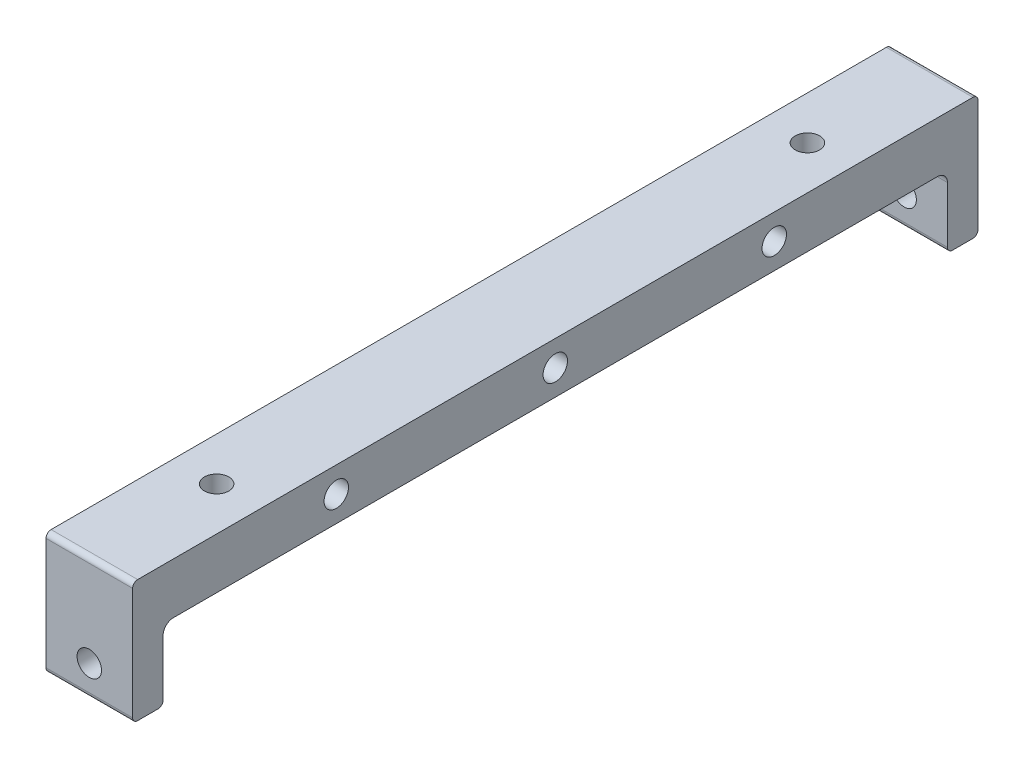
from build123d import *

# Parameters (mm, degrees)
SKETCH1_W           = 8.5
SKETCH1_H           = 12
BOSS_EXTRUDE1_DEPTH = 41.5
CUT_EXTRUDE1_DEPTH  = 43.784342931
FILLET1_R           = 0.5
M2_HOLE1_R_D        = 2.4
M2_HOLE1_R_DEPTH    = 5
M2_HOLE1_R_TIP      = 0.721032743
M2_HOLE2_T_D        = 2.4
M2_HOLE2_T_DEPTH    = 4
M2_HOLE2_T_TIP      = 0.721032743
M2_HOLE3_U_D        = 2.4
M2_HOLE3_U_DEPTH    = 10
M2_HOLE3_U_TIP      = 0.721032743
M2_HOLE4_V_D        = 2.4
M2_HOLE5_W_D        = 2.4
M2_HOLE5_W_DEPTH    = 5
M2_HOLE5_W_TIP      = 0.721032743
M2_HOLE6_Y_D        = 2.4
M2_HOLE6_Y_DEPTH    = 10
M2_HOLE6_Y_TIP      = 0.721032743


with BuildPart() as part:
    # Sketch1 → Boss-Extrude1 (new, symmetric)
    with BuildSketch(Plane.XY):
        Rectangle(SKETCH1_W, SKETCH1_H)
    extrude(amount=BOSS_EXTRUDE1_DEPTH, both=True)

    # Sketch2 → Cut-Extrude1 (cut, through all)
    with BuildSketch(Plane(origin=(4.25, 0, 0), x_dir=(0, 0, -1), z_dir=(1, 0, 0))):
        with BuildLine():
            Line((-37.5, 1), (37.5, 1))
            ThreePointArc((37.5, 1), (38.207106781, 0.707106781), (38.5, 0))
            Line((38.5, 0), (38.5, -6))
            Line((38.5, -6), (-38.5, -6))
            Line((-38.5, -6), (-38.5, 0))
            ThreePointArc((-38.5, 0), (-38.207106781, 0.707106781), (-37.5, 1))
        make_face()
    extrude(amount=-CUT_EXTRUDE1_DEPTH, mode=Mode.SUBTRACT)

    # Fillet1
    fillet1_edges = [part.edges().sort_by_distance(p)[0] for p in [
        (0, -6, 41.5),
        (0, -6, -38.5),
        (0, -6, 38.5),
        (0, -6, -41.5),
        (0, 6, -41.5),
        (0, 6, 41.5),
    ]]
    fillet(fillet1_edges, radius=FILLET1_R)

    # M2 Hole1-R
    with Locations(Plane(origin=(4.25, 0, 0), x_dir=(0, 0, -1), z_dir=(1, 0, 0))):
        with Locations((21.5, 3.5), (-21.5, 3.5)):
            Hole(M2_HOLE1_R_D / 2, depth=M2_HOLE1_R_DEPTH)
            with Locations((0, 0, -(M2_HOLE1_R_DEPTH + M2_HOLE1_R_TIP / 2))):  # 118° drill point
                Cone(0, M2_HOLE1_R_D / 2, M2_HOLE1_R_TIP, mode=Mode.SUBTRACT)

    # M2 Hole2-T
    with Locations(Plane(origin=(4.25, 0, 0), x_dir=(0, 0, -1), z_dir=(1, 0, 0))):
        with Locations((0, 3.5)):
            Hole(M2_HOLE2_T_D / 2, depth=M2_HOLE2_T_DEPTH)
            with Locations((0, 0, -(M2_HOLE2_T_DEPTH + M2_HOLE2_T_TIP / 2))):  # 118° drill point
                Cone(0, M2_HOLE2_T_D / 2, M2_HOLE2_T_TIP, mode=Mode.SUBTRACT)

    # M2 Hole3-U
    with Locations(Plane.XY.offset(41.5)):
        with Locations((0, -3)):
            Hole(M2_HOLE3_U_D / 2, depth=M2_HOLE3_U_DEPTH)
            with Locations((0, 0, -(M2_HOLE3_U_DEPTH + M2_HOLE3_U_TIP / 2))):  # 118° drill point
                Cone(0, M2_HOLE3_U_D / 2, M2_HOLE3_U_TIP, mode=Mode.SUBTRACT)

    # M2 Hole4-V (through all)
    with Locations(Plane(origin=(0, 6, 0), x_dir=(1, 0, 0), z_dir=(0, 1, 0))):
        with Locations((0, 29), (0, -29)):
            Hole(M2_HOLE4_V_D / 2)

    # M2 Hole5-W
    with Locations(Plane.ZY.offset(4.25)):
        with Locations((-35.5, 3.5), (35.5, 3.5)):
            Hole(M2_HOLE5_W_D / 2, depth=M2_HOLE5_W_DEPTH)
            with Locations((0, 0, -(M2_HOLE5_W_DEPTH + M2_HOLE5_W_TIP / 2))):  # 118° drill point
                Cone(0, M2_HOLE5_W_D / 2, M2_HOLE5_W_TIP, mode=Mode.SUBTRACT)

    # M2 Hole6-Y
    with Locations(Plane(origin=(0, 0, -41.5), x_dir=(-1, 0, 0), z_dir=(0, 0, -1))):
        with Locations((0, -3)):
            Hole(M2_HOLE6_Y_D / 2, depth=M2_HOLE6_Y_DEPTH)
            with Locations((0, 0, -(M2_HOLE6_Y_DEPTH + M2_HOLE6_Y_TIP / 2))):  # 118° drill point
                Cone(0, M2_HOLE6_Y_D / 2, M2_HOLE6_Y_TIP, mode=Mode.SUBTRACT)


solid = part.part
